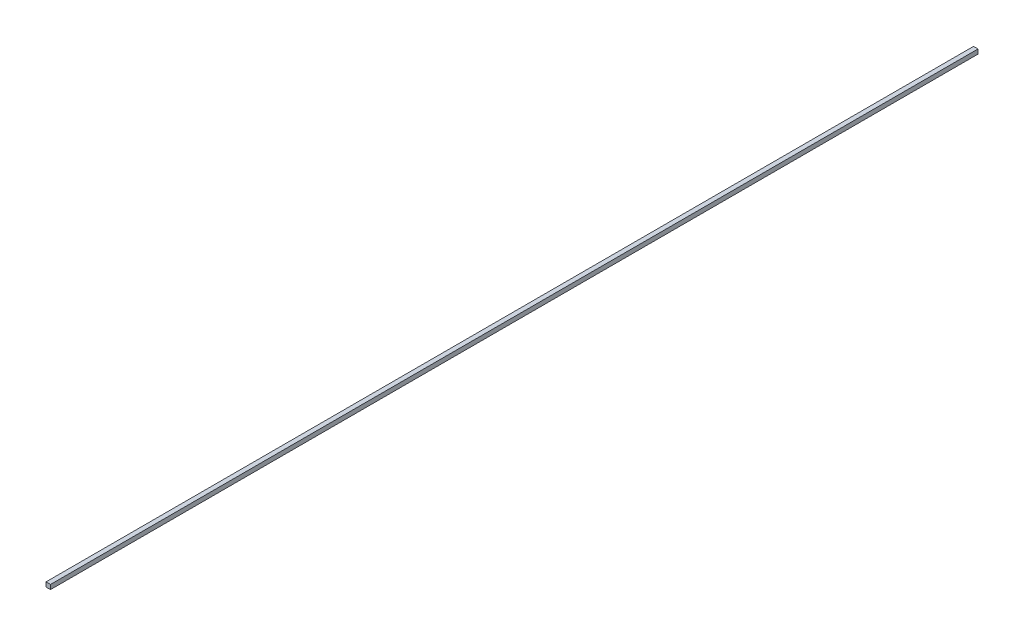
from build123d import *

# Parameters (mm, degrees)
SKETCH2_W           = 25.4
SKETCH2_H           = 25.4
BOSS_EXTRUDE1_DEPTH = 5257.8


with BuildPart() as part:
    # Sketch2 → Boss-Extrude1 (new body)
    with BuildSketch(Plane.XY):
        with Locations((12.7, 12.7)):
            Rectangle(SKETCH2_W, SKETCH2_H)
    extrude(amount=BOSS_EXTRUDE1_DEPTH)


solid = part.part
